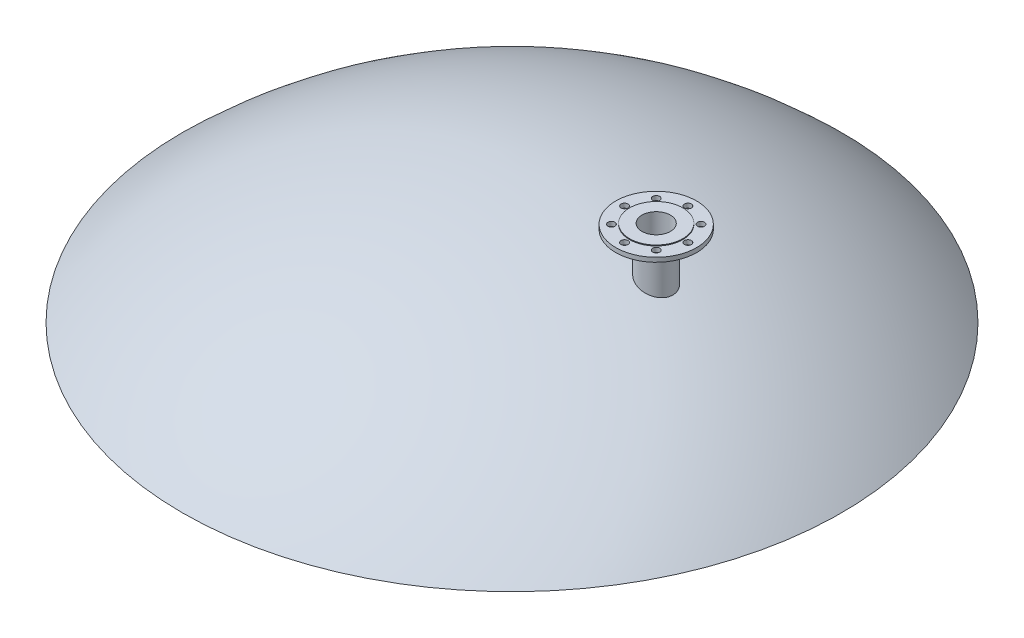
from build123d import *

# Parameters (mm, degrees)
IZIM4_R                                 = 750
KES_EKSTR_ZYON1_DEPTH                   = 1
Y_KSEKLIK_EKSTR_ZYON4_REACH             = 1098.384
Y_KSEKLIK_EKSTR_ZYON4_END_RADIUS        = 1087.5
IZIM5_R                                 = 44
IZIM5_R_2                               = 34
IZIM7_R                                 = 38.05
IZIM7_R_2                               = 32.5
Y_KSEKLIK_EKSTR_ZYON6_DEPTH             = 50
Y_KSEKLIK_EKSTR_ZYON6_DIRECTION_2_REACH = 1109.715
KES_EKSTR_ZYON3_START                   = -112.195166
IZIM8_R                                 = 32.5
KES_EKSTR_ZYON3_DEPTH                   = 23.583149
Y_KSEKLIK_EKSTR_ZYON7_START             = 10
IZIM9_R                                 = 92.5
IZIM9_R_2                               = 32.5
Y_KSEKLIK_EKSTR_ZYON7_DEPTH             = 10
Y_KSEKLIK_EKSTR_ZYON8_START             = 2
IZIM10_R                                = 61
IZIM10_R_2                              = 32.5
Y_KSEKLIK_EKSTR_ZYON8_DEPTH             = 2
IZIM13_R                                = 8
KES_EKSTR_ZYON4_DEPTH                   = 20


with BuildPart() as part:
    # Çizim1 → Döndür1 (revolve)
    with BuildSketch(Plane.XY):
        with BuildLine():
            Line((-754, 0), (-750, 0))
            ThreePointArc((-750, 0), (-403.887360535, 222.218401338), (0, 300))
            Line((0, 300), (0, 302.762468399))
            ThreePointArc((0, 302.762468399), (-406.257649858, 224.244519102), (-754, 0))
        make_face()
    revolve(axis=Axis((0, 399.218535943, 0), (0, -1, 0)))

    # Çizim4 → Kes-Ekstrüzyon1 (cut)
    with BuildSketch(Plane.XZ):
        with Locations(Location((0, 0, 0), (0, 0, 270))):
            Circle(IZIM4_R)
    extrude(amount=-KES_EKSTR_ZYON1_DEPTH, mode=Mode.SUBTRACT)

    # Çizim7 → Yükseklik-Ekstrüzyon6 (add)
    with BuildSketch(Plane(origin=(0, 300, 0), x_dir=(1, 0, 0), z_dir=(0, 1, 0))):
        with Locations(Location((330, 0, 0), (0, 0, 270))):
            Circle(IZIM7_R)
        with Locations(Location((330, 0, 0), (0, 0, 270))):
            Circle(IZIM7_R_2, mode=Mode.SUBTRACT)
    extrude(amount=Y_KSEKLIK_EKSTR_ZYON6_DEPTH)

    # Çizim7 → Yükseklik-Ekstrüzyon6 direction 2 (add, up to next)
    with BuildSketch(Plane(origin=(0, 300, 0), x_dir=(1, 0, 0), z_dir=(0, 1, 0)), mode=Mode.PRIVATE) as y_kseklik_ekstr_zyon6_direction_2_sk1:
        with Locations(Location((330, 0, 0), (0, 0, 270))):
            Circle(IZIM7_R)
        with Locations(Location((330, 0, 0), (0, 0, 270))):
            Circle(IZIM7_R_2, mode=Mode.SUBTRACT)
    y_kseklik_ekstr_zyon6_direction_2_tool1 = extrude(y_kseklik_ekstr_zyon6_direction_2_sk1.sketch, amount=-Y_KSEKLIK_EKSTR_ZYON6_DIRECTION_2_REACH, mode=Mode.PRIVATE) - part.part
    add(y_kseklik_ekstr_zyon6_direction_2_tool1.solids().sort_by_distance((330, 300, -36.973783))[0])

    # Çizim8 → Kes-Ekstrüzyon3 (cut)
    with BuildSketch(Plane(origin=(0, 350, 0), x_dir=(1, 0, 0), z_dir=(0, 1, 0)).offset(KES_EKSTR_ZYON3_START)):
        with Locations(Location((330, 0, 0), (0, 0, 270))):
            Circle(IZIM8_R)
    extrude(amount=KES_EKSTR_ZYON3_DEPTH, mode=Mode.SUBTRACT)

    # Çizim9 → Yükseklik-Ekstrüzyon7 (add)
    with BuildSketch(Plane(origin=(0, 350, 0), x_dir=(1, 0, 0), z_dir=(0, 1, 0)).offset(Y_KSEKLIK_EKSTR_ZYON7_START)):
        with Locations(Location((330, 0, 0), (0, 0, 270))):
            Circle(IZIM9_R)
        with Locations(Location((330, 0, 0), (0, 0, 270))):
            Circle(IZIM9_R_2, mode=Mode.SUBTRACT)
    extrude(amount=-Y_KSEKLIK_EKSTR_ZYON7_DEPTH)

    # Çizim10 → Yükseklik-Ekstrüzyon8 (add)
    with BuildSketch(Plane(origin=(0, 360, 0), x_dir=(1, 0, 0), z_dir=(0, 1, 0)).offset(Y_KSEKLIK_EKSTR_ZYON8_START)):
        with Locations(Location((330, 0, 0), (0, 0, 270))):
            Circle(IZIM10_R)
        with Locations(Location((330, 0, 0), (0, 0, 270))):
            Circle(IZIM10_R_2, mode=Mode.SUBTRACT)
    extrude(amount=-Y_KSEKLIK_EKSTR_ZYON8_DEPTH)

    # Çizim13 → Kes-Ekstrüzyon4 (cut)
    with BuildSketch(Plane(origin=(0, 360, 0), x_dir=(1, 0, 0), z_dir=(0, 1, 0))):
        with Locations(Location((257.5, 0, 0), (0, 0, 270))):
            Circle(IZIM13_R)
        with Locations(Location((278.734758364, 51.265241636, 0), (0, 0, 270))):
            Circle(IZIM13_R)
        with Locations(Location((330, 72.5, 0), (0, 0, 270))):
            Circle(IZIM13_R)
        with Locations(Location((381.265241636, 51.265241636, 0), (0, 0, 270))):
            Circle(IZIM13_R)
        with Locations(Location((402.5, 0, 0), (0, 0, 270))):
            Circle(IZIM13_R)
        with Locations(Location((381.265241636, -51.265241636, 0), (0, 0, 270))):
            Circle(IZIM13_R)
        with Locations(Location((330, -72.5, 0), (0, 0, 270))):
            Circle(IZIM13_R)
        with Locations(Location((278.734758364, -51.265241636, 0), (0, 0, 270))):
            Circle(IZIM13_R)
    extrude(amount=-KES_EKSTR_ZYON4_DEPTH, mode=Mode.SUBTRACT)


with BuildPart() as body_2:
    # Yükseklik-Ekstrüzyon4: up to this sphere (the profile starts inside it)
    y_kseklik_ekstr_zyon4_end = Location((0, -787.5, 0)) * Sphere(Y_KSEKLIK_EKSTR_ZYON4_END_RADIUS, mode=Mode.PRIVATE)
    # Çizim5 → Yükseklik-Ekstrüzyon4 (new, up to the surface)
    with BuildSketch(Plane(origin=(0, 255, 0), x_dir=(1, 0, 0), z_dir=(0, 1, 0)), mode=Mode.PRIVATE) as y_kseklik_ekstr_zyon4_sk1:
        with Locations(Location((0, 0, 0), (0, 0, 180))):
            Circle(IZIM5_R)
        with Locations(Location((0, 0, 0), (0, 0, 180))):
            Circle(IZIM5_R_2, mode=Mode.SUBTRACT)
    y_kseklik_ekstr_zyon4_tool1 = extrude(y_kseklik_ekstr_zyon4_sk1.sketch, amount=Y_KSEKLIK_EKSTR_ZYON4_REACH, mode=Mode.PRIVATE) & y_kseklik_ekstr_zyon4_end
    add(y_kseklik_ekstr_zyon4_tool1.solids().sort_by_distance((42.755492, 255, 0))[0])


solid = Compound([part.part, body_2.part])
